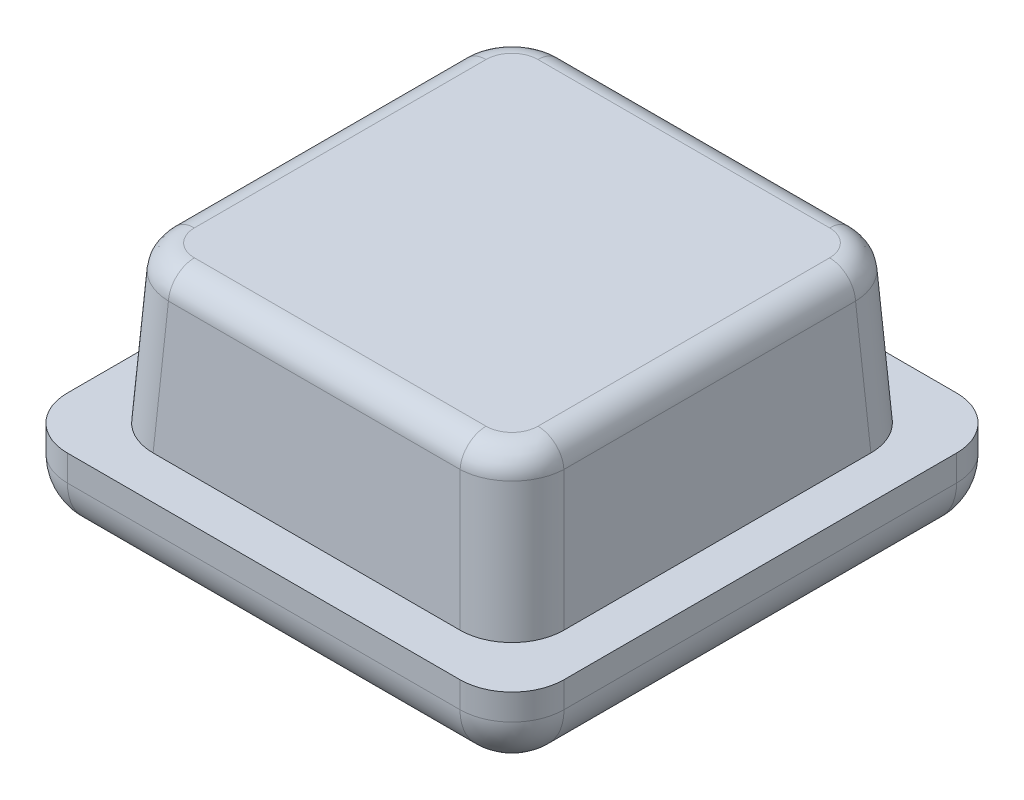
from build123d import *

# Parameters (mm, degrees)
SKETCH1_W           = 19.1
SKETCH1_H           = 19.1
BOSS_EXTRUDE1_DEPTH = 3
FILLET1_R           = 2
FILLET2_R           = 1
FILLET3_R           = 2


with BuildPart() as part:
    # Sketch1 → Boss-Extrude1 (new body)
    with BuildSketch(Plane(origin=(0, 0, 0), x_dir=(1, 0, 0), z_dir=(0, 1, 0))):
        with Locations((9.55, 9.55)):
            Rectangle(SKETCH1_W, SKETCH1_H)
    extrude(amount=BOSS_EXTRUDE1_DEPTH)

    # Sketch2 → Loft1 section 0
    with BuildSketch(Plane(origin=(0, 3, 0), x_dir=(1, 0, 0), z_dir=(0, 1, 0))):
        with BuildLine():
            Line((1.65, 1.65), (17.45, 1.65))
            Line((17.45, 1.65), (17.45, 17.45))
            Line((17.45, 17.45), (1.65, 17.45))
            Line((1.65, 17.45), (1.65, 1.65))
        make_face()
    # Sketch3 → Loft1 section 1
    with BuildSketch(Plane(origin=(0, 9, 0), x_dir=(1, 0, 0), z_dir=(0, 1, 0))):
        with BuildLine():
            Line((2, 2), (17.1, 2))
            Line((17.1, 2), (17.1, 17.1))
            Line((17.1, 17.1), (2, 17.1))
            Line((2, 17.1), (2, 2))
        make_face()
    loft()

    # Fillet1
    fillet1_edges = [part.edges().sort_by_distance(p)[0] for p in [
        (17.275, 6, -1.825),
        (17.275, 6, -17.275),
        (1.825, 6, -17.275),
        (1.825, 6, -1.825),
        (19.1, 1.5, 0),
        (0, 1.5, 0),
        (19.1, 1.5, -19.1),
        (0, 1.5, -19.1),
    ]]
    fillet(fillet1_edges, radius=FILLET1_R)

    # Fillet2
    fillet2_edges = [part.edges().sort_by_distance(p)[0] for p in [
        (2.584382231, 9, -16.515617769),
        (9.55, 9, -17.1),
        (16.515617769, 9, -16.515617769),
        (17.1, 9, -9.55),
        (16.515617769, 9, -2.584382231),
        (9.55, 9, -2),
        (2.584382231, 9, -2.584382231),
        (2, 9, -9.55),
    ]]
    fillet(fillet2_edges, radius=FILLET2_R)

    # Fillet3
    fillet3_edges = [part.edges().sort_by_distance(p)[0] for p in [
        (19.1, 0, -9.55),
        (0, 0, -9.55),
        (9.55, 0, -19.1),
        (9.55, 0, 0),
        (0.585786438, 0, -18.514213562),
        (18.514213562, 0, -18.514213562),
        (0.585786438, 0, -0.585786438),
        (18.514213562, 0, -0.585786438),
    ]]
    fillet(fillet3_edges, radius=FILLET3_R)


solid = part.part
